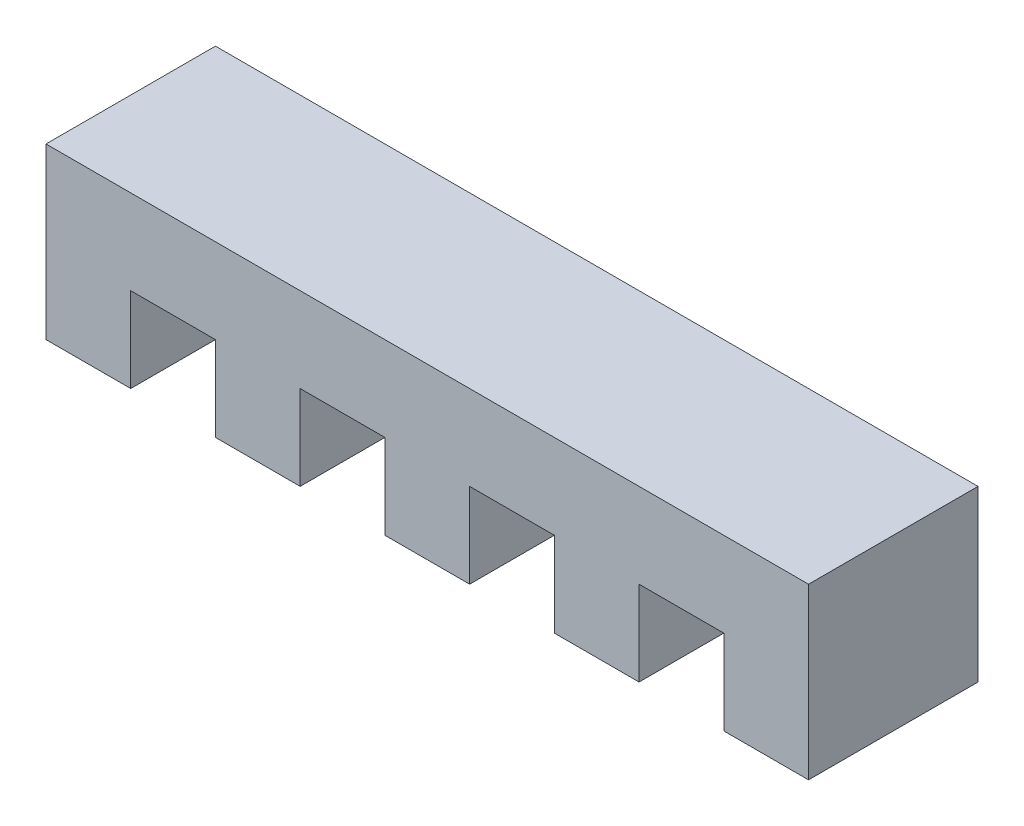
from build123d import *

# Parameters (mm, degrees)
BOSS_EXTRU_1_DEPTH = 20


with BuildPart() as part:
    # Esquisse1 → Boss.-Extru.1 (new body)
    with BuildSketch(Plane.XY):
        Polygon((-5, 0), (5, 0), (5, 10), (15, 10), (15, 0), (25, 0), (25, 10), (35, 10), (35, 0), (45, 0), (45, 20), (-45, 20), (-45, 0), (-35, 0), (-35, 10), (-25, 10), (-25, 0), (-15, 0), (-15, 10), (-5, 10), align=None)
    extrude(amount=BOSS_EXTRU_1_DEPTH)


solid = part.part
